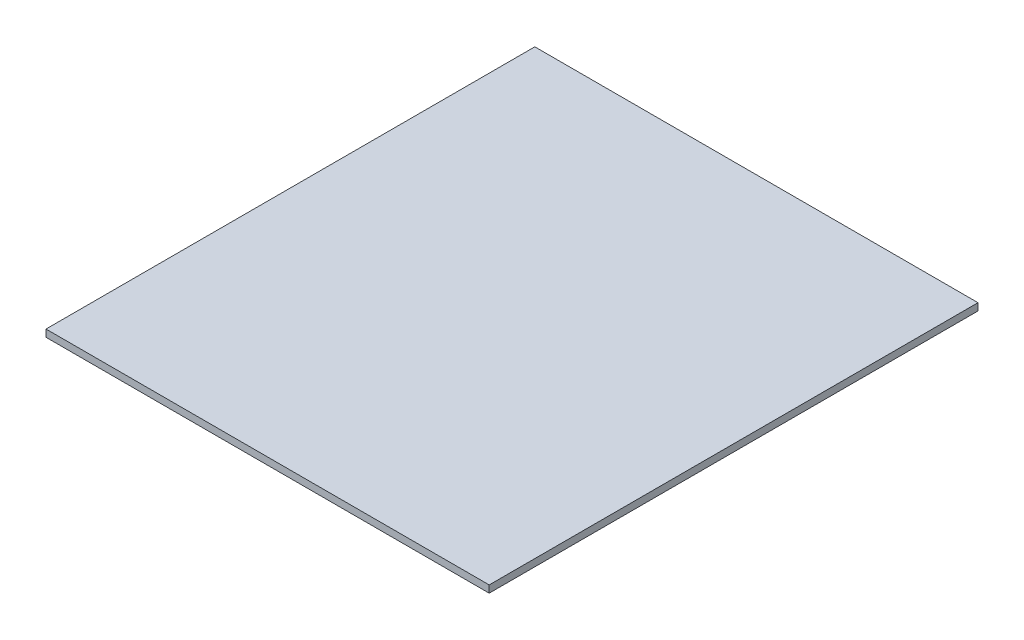
from build123d import *

# Parameters (mm, degrees)
SKETCH4_W           = 680
SKETCH4_H           = 750
BOSS_EXTRUDE1_DEPTH = 11


with BuildPart() as part:
    # Sketch4 → Boss-Extrude1 (new body)
    with BuildSketch(Plane(origin=(0, 0, 0), x_dir=(1, 0, 0), z_dir=(0, 1, 0))):
        Rectangle(SKETCH4_W, SKETCH4_H)
    extrude(amount=BOSS_EXTRUDE1_DEPTH)


solid = part.part
